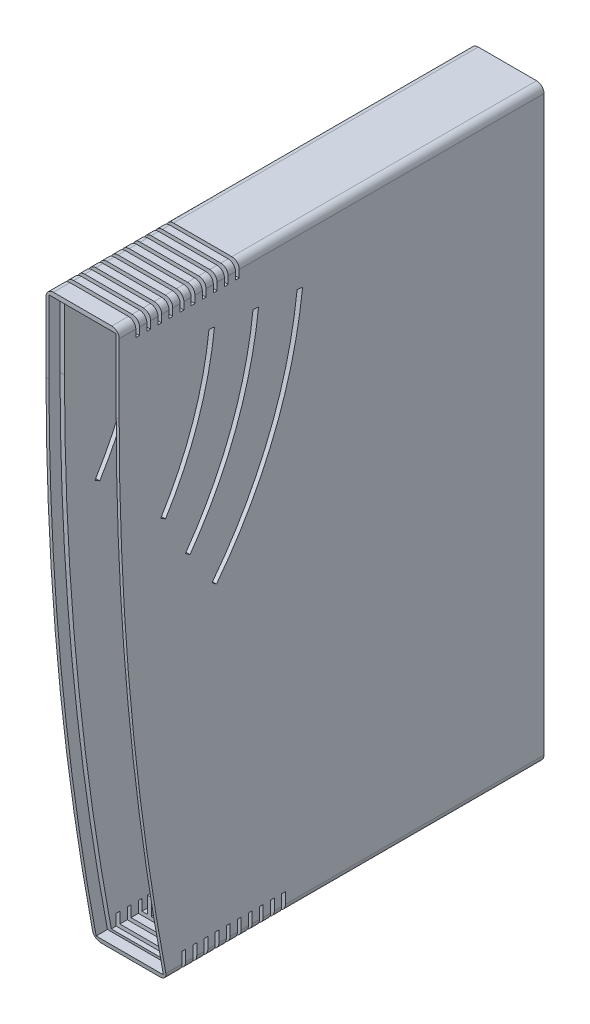
from build123d import *

# Parameters (mm, degrees)
SKETCH1_W               = 19.81
SKETCH1_H               = 159.1
BOSS_EXTRUDE1_DEPTH     = 115
SHELL1_T                = -2
CUT_EXTRUDE1_DEPTH      = 142.229028886
CUT_EXTRUDE1_DEPTH_BACK = 142.229028886
FILLET1_R               = 2
SKETCH3_W               = 21
SKETCH3_H               = 1
CUT_EXTRUDE2_DEPTH      = 4
LPATTERN1_COUNT         = 10
LPATTERN1_PITCH         = 3
SKETCH8_W               = 27.700077209
SKETCH8_H               = 1
CUT_EXTRUDE4_DEPTH      = 5
LPATTERN2_COUNT         = 10
LPATTERN2_PITCH         = 3
CUT_EXTRUDE3_DEPTH      = 142.229029037
SKETCH7_W               = 1
SKETCH7_H               = 4.5
BOSS_EXTRUDE3_DEPTH     = 90
CHAMFER2_SIZE           = 0.5
CUT_EXTRUDE6_DEPTH      = 9.105
SKETCH11_W              = 1
SKETCH11_H              = 4.5
BOSS_EXTRUDE6_DEPTH     = 89
SKETCH12_W              = 16.31
SKETCH12_H              = 24.4
SKETCH12_W_2            = 16.9
SKETCH12_H_2            = 18.5
SKETCH12_W_3            = 14.249996967
SKETCH12_H_3            = 11.25
CUT_EXTRUDE7_DEPTH      = 2


with BuildPart() as part:
    # Sketch1 → Boss-Extrude1 (new body)
    with BuildSketch(Plane.XY):
        Rectangle(SKETCH1_W, SKETCH1_H)
    extrude(amount=BOSS_EXTRUDE1_DEPTH)

    # Shell1
    shell1_openings = [part.faces().sort_by_distance(p)[0] for p in [
        (0, 0, 115),
    ]]
    offset(amount=SHELL1_T, openings=shell1_openings, kind=Kind.INTERSECTION)

    # Sketch2 → Cut-Extrude1 (cut, two sides: drawn at the far end of the back side and taken through both)
    with BuildSketch(Plane(origin=(9.905, 0, 0), x_dir=(0, 0, -1), z_dir=(1, 0, 0)).offset(-CUT_EXTRUDE1_DEPTH_BACK)):
        with BuildLine():
            Line((-115, 482.170987722), (-115, 79.55))
            Line((-115, 79.55), (-115, 58.65))
            ThreePointArc((-115, 58.65), (-111.742842211, -10.755043044), (-102, -79.55))
            Line((-102, -79.55), (-26.918013628, -475.108282781))
            Line((-26.918013628, -475.108282781), (-828.772746701, -548.88921573))
            Line((-828.772746701, -548.88921573), (-916.854733073, 408.390054773))
            Line((-916.854733073, 408.390054773), (-115, 482.170987722))
        make_face()
    extrude(amount=CUT_EXTRUDE1_DEPTH + CUT_EXTRUDE1_DEPTH_BACK, mode=Mode.SUBTRACT)

    # Fillet1
    fillet1_edges = [part.edges().sort_by_distance(p)[0] for p in [
        (9.905, -79.55, 51),
        (-9.905, -79.55, 51),
        (-9.905, 79.55, 57.5),
        (9.905, 79.55, 57.5),
    ]]
    fillet(fillet1_edges, radius=FILLET1_R)

    # Sketch3 → Cut-Extrude2 (cut)
    with BuildSketch(Plane(origin=(0, 79.55, 0), x_dir=(1, 0, 0), z_dir=(0, 1, 0))):
        with Locations((0, -110)):
            Rectangle(SKETCH3_W, SKETCH3_H)
    cut_extrude2 = extrude(amount=-CUT_EXTRUDE2_DEPTH, mode=Mode.SUBTRACT)

    # LPattern1: Cut-Extrude2 ×10
    with Locations(*[(0, 0, -i * LPATTERN1_PITCH) for i in range(1, LPATTERN1_COUNT)]):
        add(cut_extrude2, mode=Mode.SUBTRACT)

    # Sketch8 → Cut-Extrude4 (cut)
    with BuildSketch(Plane.XZ.offset(79.55)):
        with Locations((0.524208986, 97.5)):
            Rectangle(SKETCH8_W, SKETCH8_H)
    cut_extrude4 = extrude(amount=-CUT_EXTRUDE4_DEPTH, mode=Mode.SUBTRACT)

    # LPattern2: Cut-Extrude4 ×10
    with Locations(*[(0, 0, -i * LPATTERN2_PITCH) for i in range(1, LPATTERN2_COUNT)]):
        add(cut_extrude4, mode=Mode.SUBTRACT)

    # Sketch5 → Cut-Extrude3 (cut, through all)
    with BuildSketch(Plane.ZY.offset(9.905)):
        with BuildLine():
            Line((65.347036406, 64.823533738), (66.838155653, 64.986516539))
            ThreePointArc((66.838155653, 64.986516539), (74.40797048, 34.807641847), (89.855449244, 7.799458383))
            Line((89.855449244, 7.799458383), (88.667189124, 6.88401429))
            ThreePointArc((88.667189124, 6.88401429), (73.01645406, 34.24756859), (65.347036406, 64.823533738))
        make_face()
        with BuildLine():
            Line((77.275990376, 66.127396149), (78.767109622, 66.29037895))
            ThreePointArc((78.767109622, 66.29037895), (84.83196797, 41.097147113), (97.049571899, 18.245197712))
            Line((97.049571899, 18.245197712), (95.827312392, 17.375668128))
            ThreePointArc((95.827312392, 17.375668128), (83.430037817, 40.563675608), (77.275990376, 66.127396149))
        make_face()
        with BuildLine():
            Line((89.204944346, 67.431258559), (90.696063592, 67.594241361))
            ThreePointArc((90.696063592, 67.594241361), (95.094328846, 47.99151385), (103.7314578, 29.852835107))
            Line((103.7314578, 29.852835107), (102.457595124, 29.060828868))
            ThreePointArc((102.457595124, 29.060828868), (93.67651402, 47.501818923), (89.204944346, 67.431258559))
        make_face()
    extrude(amount=-CUT_EXTRUDE3_DEPTH, mode=Mode.SUBTRACT)

    # Sketch7 → Boss-Extrude3 (add)
    with BuildSketch(Plane.XY.offset(95)):
        with Locations((-5.905, 75.3)):
            Rectangle(SKETCH7_W, SKETCH7_H)
        with Locations((-3.105, 75.3)):
            Rectangle(SKETCH7_W, SKETCH7_H)
    extrude(amount=-BOSS_EXTRUDE3_DEPTH)

    # Chamfer2
    chamfer2_edges = [part.edges().sort_by_distance(p)[0] for p in [
        (-3.605, 75.3, 95),
        (-5.405, 75.3, 95),
    ]]
    chamfer(chamfer2_edges, length=CHAMFER2_SIZE)

    # Sketch10 → Cut-Extrude6 (cut, symmetric)
    with BuildSketch(Plane(origin=(0, 0, 0), x_dir=(0, 0, -1), z_dir=(1, 0, 0))):
        with BuildLine():
            Line((-131.709183252, 78.35), (-112, 78.35))
            Line((-112, 78.35), (-112, 58.65))
            ThreePointArc((-112, 58.65), (-108.78648369, -10.149542881), (-99.173917094, -78.35))
            Line((-99.173917094, -78.35), (-102.923842912, -78.35))
            Line((-102.923842912, -78.35), (-131.709183252, 78.35))
        make_face()
    extrude(amount=CUT_EXTRUDE6_DEPTH, both=True, mode=Mode.SUBTRACT)

    # Sketch11 → Boss-Extrude6 (add)
    with BuildSketch(Plane.XY.offset(2)):
        with Locations((-5.905, -75.3)):
            Rectangle(SKETCH11_W, SKETCH11_H)
        with Locations((-3.105, -75.3)):
            Rectangle(SKETCH11_W, SKETCH11_H)
    extrude(amount=BOSS_EXTRUDE6_DEPTH)

    # Sketch12 → Cut-Extrude7 (cut)
    with BuildSketch(Plane(origin=(0, 0, 0), x_dir=(-1, 0, 0), z_dir=(0, 0, -1))):
        with Locations((-0.25, 59.25)):
            Rectangle(SKETCH12_W, SKETCH12_H)
        with Locations((0.005, -8.8)):
            Rectangle(SKETCH12_W_2, SKETCH12_H_2)
        with Locations((0.005, -46.12)):
            Rectangle(SKETCH12_W_2, SKETCH12_H_2)
        with Locations((0.179998483, -65.806322554)):
            Rectangle(SKETCH12_W_3, SKETCH12_H_3)
    extrude(amount=-CUT_EXTRUDE7_DEPTH, mode=Mode.SUBTRACT)


solid = part.part
